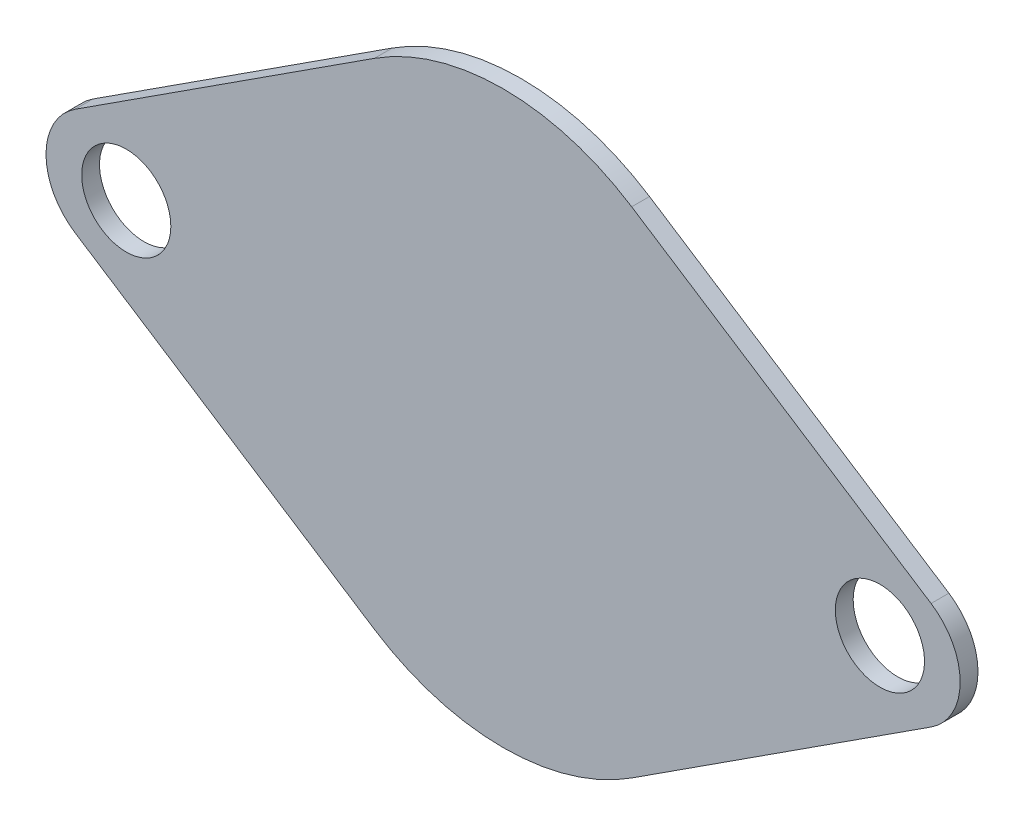
from build123d import *

# Parameters (mm, degrees)
ESQUISSE1_R        = 2.5
BOSS_EXTRU_1_DEPTH = 1


with BuildPart() as part:
    # Esquisse1 → Boss.-Extru.1 (new body)
    with BuildSketch(Plane.XY):
        with BuildLine():
            Line((0, 0), (16.788598575, 10.86935867))
            ThreePointArc((16.788598575, 10.86935867), (24, 13), (31.211401425, 10.86935867))
            Line((31.211401425, 10.86935867), (48, 0))
            ThreePointArc((48, 0), (49.631578947, -3), (48, -6))
            Line((48, -6), (31.211401425, -16.86935867))
            ThreePointArc((31.211401425, -16.86935867), (24, -19), (16.788598575, -16.86935867))
            Line((16.788598575, -16.86935867), (0, -6))
            ThreePointArc((0, -6), (-1.631578947, -3), (0, 0))
        make_face()
        with Locations((2.868421053, -3)):
            Circle(ESQUISSE1_R, mode=Mode.SUBTRACT)
        with Locations(Location((45.131578947, -3, 0), (0, 0, 180))):
            Circle(ESQUISSE1_R, mode=Mode.SUBTRACT)
    extrude(amount=BOSS_EXTRU_1_DEPTH)


solid = part.part
